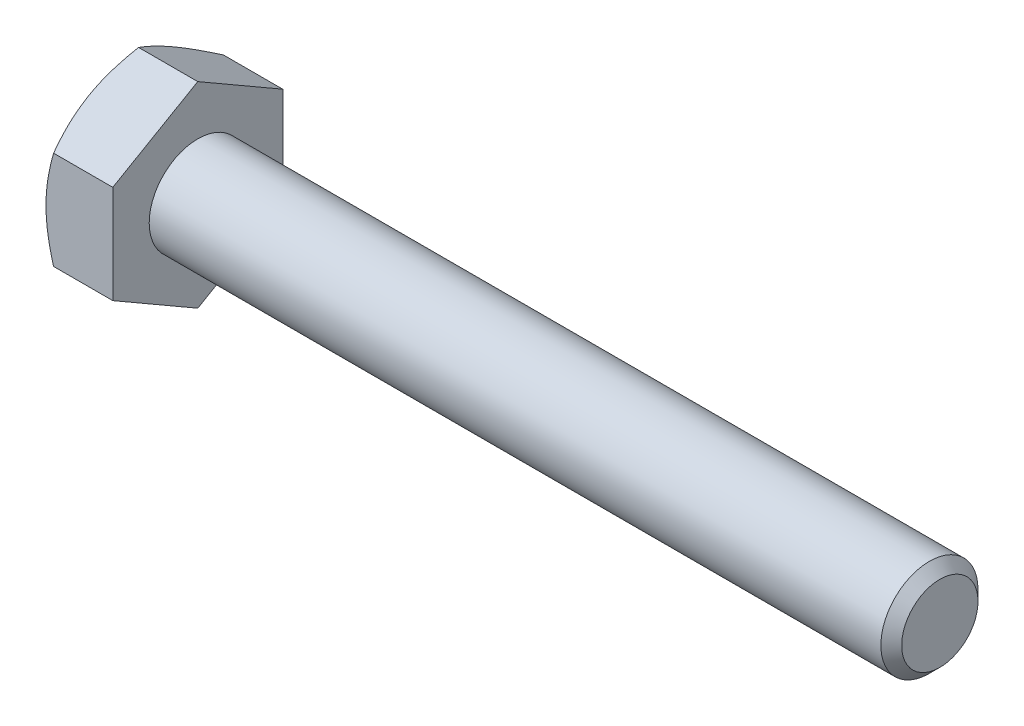
from build123d import *

# Parameters (mm, degrees)
SKETCH5_R           = 3.175
BOSS_EXTRUDE3_DEPTH = 48.514
CHAMFER1_SIZE       = 0.680357143
BOSS_EXTRUDE4_DEPTH = 4.365625
SKETCH8_OUTSIDE_W   = 213.208
SKETCH8_OUTSIDE_H   = 214.928
SKETCH8_OUTSIDE_R   = 5.55625
CUT_EXTRUDE3_DEPTH  = 54.55641144
CUT_EXTRUDE3_DRAFT  = -60


with BuildPart() as part:
    # Sketch5 → Boss-Extrude3 (new body)
    with BuildSketch(Plane(origin=(26.4398125, 0, 0), x_dir=(0, 0, -1), z_dir=(1, 0, 0))):
        Circle(SKETCH5_R)
    extrude(amount=-BOSS_EXTRUDE3_DEPTH)

    # Chamfer1
    chamfer1_edges = [part.edges().sort_by_distance(p)[0] for p in [
        (26.4398125, 0, 3.175),
    ]]
    chamfer(chamfer1_edges, length=CHAMFER1_SIZE)

    # Sketch6 → Boss-Extrude4 (add)
    with BuildSketch(Plane.ZY.offset(22.0741875)):
        Polygon((5.55625, 3.207902433), (0, 6.415804866), (-5.55625, 3.207902433), (-5.55625, -3.207902433), (0, -6.415804866), (5.55625, -3.207902433), align=None)
    extrude(amount=BOSS_EXTRUDE4_DEPTH)


with BuildPart() as cut_extrude3_tool:
    # Sketch8 outside → Cut-Extrude3 (with draft: the straight prism first)
    with BuildSketch(Plane.ZY.offset(26.4398125)):
        Rectangle(SKETCH8_OUTSIDE_W, SKETCH8_OUTSIDE_H)
        Circle(SKETCH8_OUTSIDE_R, mode=Mode.SUBTRACT)
    extrude(amount=-CUT_EXTRUDE3_DEPTH)
    # Cut-Extrude3: the draft: its side faces are tilted about the plane it starts from
    cut_extrude3_sides = [cut_extrude3_tool.faces().sort_by_distance(p)[0] for p in [
        (0.83839322, -107.464, 0),
        (0.83839322, 0, 106.604),
        (0.83839322, 107.464, 0),
        (0.83839322, 0, -106.604),
        (0.83839322, 0, -5.55625),
    ]]
    draft(cut_extrude3_sides, Plane.ZY.offset(26.4398125), CUT_EXTRUDE3_DRAFT)


with BuildPart() as part_1:
    add(part.part)

    # Cut-Extrude3: cut by cut_extrude3_tool
    add(cut_extrude3_tool.part, mode=Mode.SUBTRACT)


solid = part_1.part
